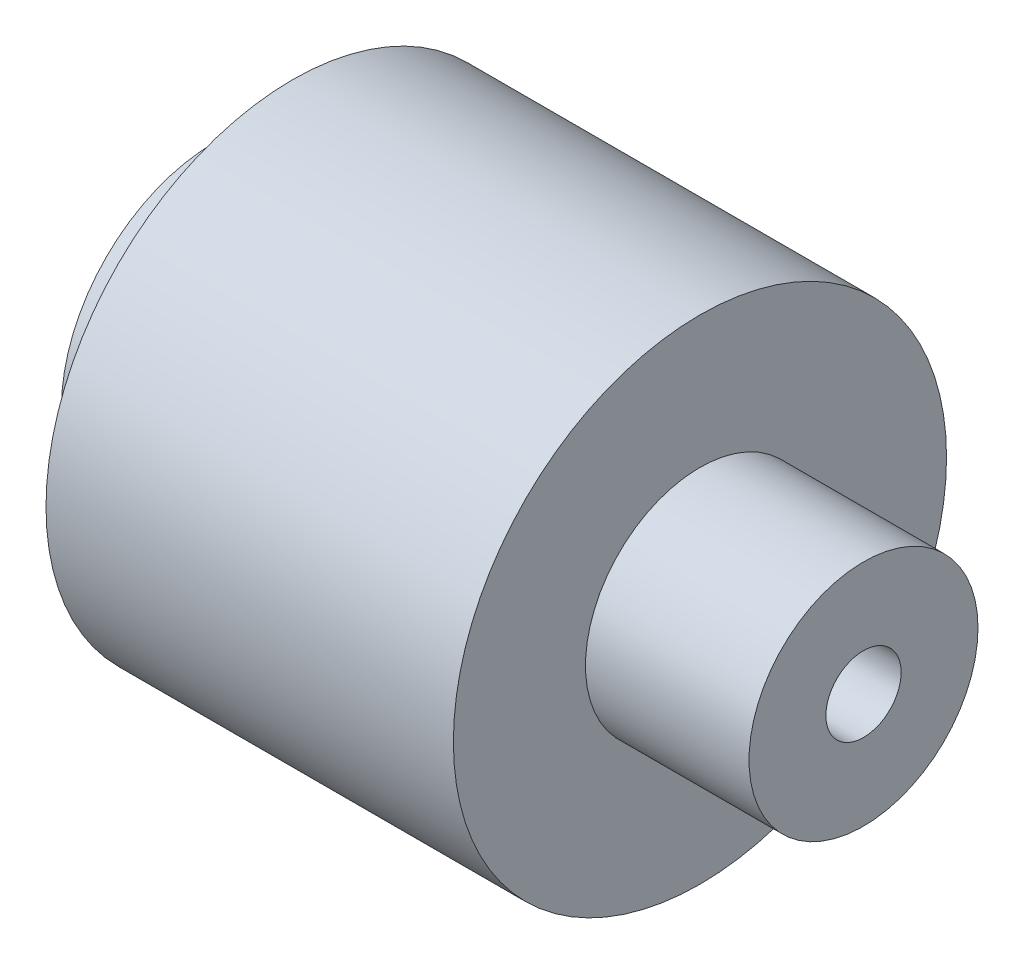
from build123d import *
from build123d.topology import SkipClean

# Parameters (mm, degrees)
SKETCH1_R           = 15.07617
BOSS_EXTRUDE1_DEPTH = 34.9071592
SKETCH2_R           = 9.3853
SKETCH2_R_2         = 4.5847
BOSS_EXTRUDE2_DEPTH = 4.7498
CUT_EXTRUDE1_DEPTH  = 26
SKETCH4_R           = 2.3
CUT_EXTRUDE2_DEPTH  = 2.6
CUT_EXTRUDE3_START  = -10
SKETCH5_R           = 15.07617
SKETCH5_R_2         = 7
CUT_EXTRUDE3_DEPTH  = 10


with BuildPart() as part:
    # Sketch1 → Boss-Extrude1 (new body)
    with BuildSketch(Plane(origin=(0, 0, 0), x_dir=(0, 0, -1), z_dir=(1, 0, 0))):
        Circle(SKETCH1_R)
    extrude(amount=BOSS_EXTRUDE1_DEPTH)

    # Sketch2 → Boss-Extrude2 (add)
    with BuildSketch(Plane.ZY):
        with Locations(Location((0, 0, 0), (0, 0, 180))):
            Circle(SKETCH2_R)
        Circle(SKETCH2_R_2, mode=Mode.SUBTRACT)
    extrude(amount=BOSS_EXTRUDE2_DEPTH)

    # Sketch3 → Cut-Extrude1 (cut)
    with BuildSketch(Plane(origin=(34.9071592, 0, 0), x_dir=(0, 0, -1), z_dir=(1, 0, 0))):
        with BuildLine():
            Line((-1.775, 1.462660248), (1.775, 1.462660248))
            ThreePointArc((1.775, 1.462660248), (0, -2.3), (-1.775, 1.462660248))
        make_face()
    extrude(amount=-CUT_EXTRUDE1_DEPTH, mode=Mode.SUBTRACT)

    # Sketch4 → Cut-Extrude2 (cut)
    with SkipClean():  # the faces are left unmerged after this step: merging them gives an invalid solid
        with BuildSketch(Plane(origin=(34.9071592, 0, 0), x_dir=(0, 0, -1), z_dir=(1, 0, 0))):
            Circle(SKETCH4_R)
        extrude(amount=-CUT_EXTRUDE2_DEPTH, mode=Mode.SUBTRACT)

    # Sketch5 → Cut-Extrude3 (cut)
    with SkipClean():  # the faces are left unmerged after this step: merging them gives an invalid solid
        with BuildSketch(Plane(origin=(34.9071592, 0, 0), x_dir=(0, 0, -1), z_dir=(1, 0, 0)).offset(CUT_EXTRUDE3_START)):
            Circle(SKETCH5_R)
            Circle(SKETCH5_R_2, mode=Mode.SUBTRACT)
        extrude(amount=CUT_EXTRUDE3_DEPTH, mode=Mode.SUBTRACT)


solid = part.part
